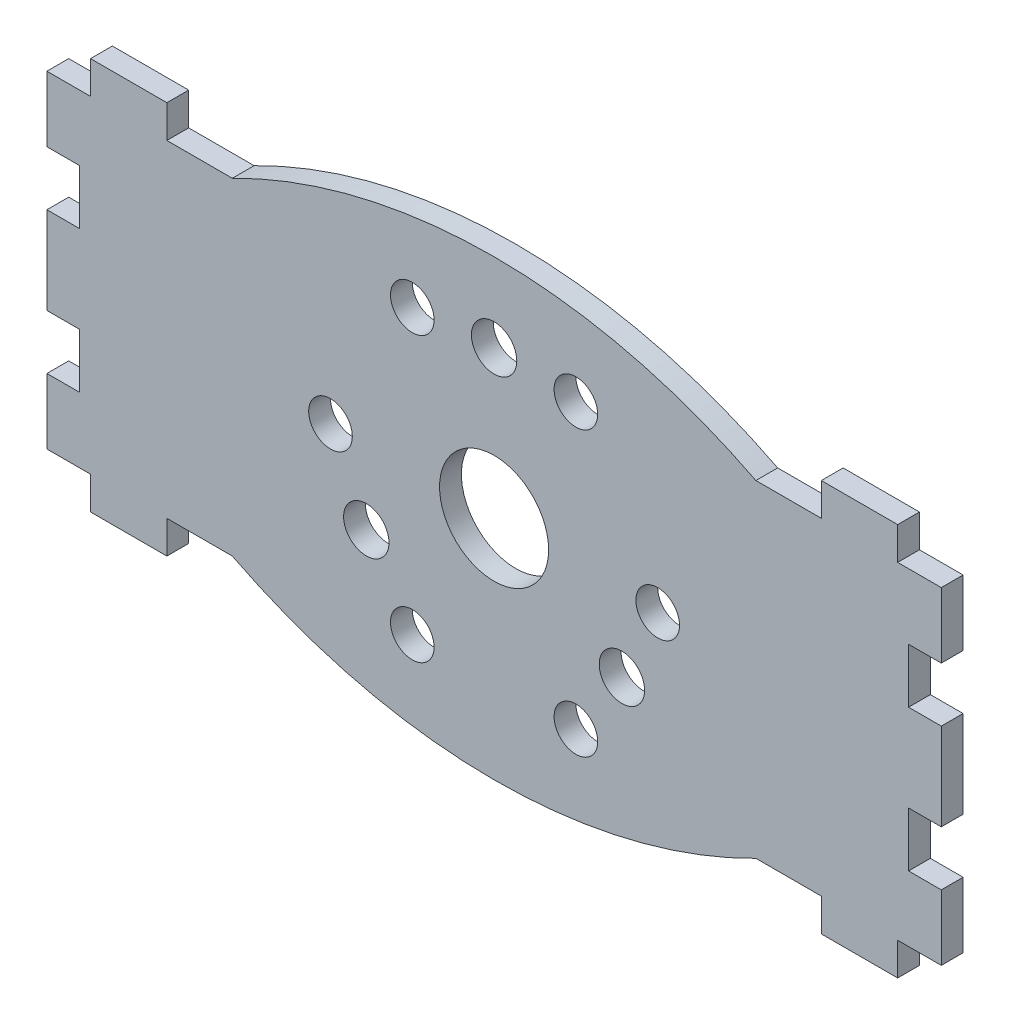
from build123d import *

# Parameters (mm, degrees)
SKETCH_1_R      = 2
SKETCH_1_R_2    = 2.08
SKETCH_1_R_3    = 5
EXTRUDE_2_DEPTH = 2


with BuildPart() as part:
    # 草图1 → 凸台-拉伸2 (new body)
    with BuildSketch(Plane.XY):
        with BuildLine():
            ThreePointArc((-24, -15), (0, -20.769061509), (24, -15))
            Line((24, -15), (30, -15))
            Line((30, -15), (30, -18))
            Line((30, -18), (37, -18))
            Line((37, -18), (37, -15))
            Line((37, -15), (41, -15))
            Line((41, -15), (41, -9))
            Line((41, -9), (38, -9))
            Line((38, -9), (38, -4))
            Line((38, -4), (41, -4))
            Line((41, -4), (41, 4))
            Line((41, 4), (38, 4))
            Line((38, 4), (38, 9))
            Line((38, 9), (41, 9))
            Line((41, 9), (41, 15))
            Line((41, 15), (37, 15))
            Line((37, 15), (37, 18))
            Line((37, 18), (30, 18))
            Line((30, 18), (30, 15))
            Line((30, 15), (24, 15))
            ThreePointArc((24, 15), (0, 20.769061509), (-24, 15))
            Line((-24, 15), (-30, 15))
            Line((-30, 15), (-30, 18))
            Line((-30, 18), (-37, 18))
            Line((-37, 18), (-37, 15))
            Line((-37, 15), (-41, 15))
            Line((-41, 15), (-41, 9))
            Line((-41, 9), (-38, 9))
            Line((-38, 9), (-38, 4))
            Line((-38, 4), (-41, 4))
            Line((-41, 4), (-41, -4))
            Line((-41, -4), (-38, -4))
            Line((-38, -4), (-38, -9))
            Line((-38, -9), (-41, -9))
            Line((-41, -9), (-41, -15))
            Line((-41, -15), (-37, -15))
            Line((-37, -15), (-37, -18))
            Line((-37, -18), (-30, -18))
            Line((-30, -18), (-30, -15))
            Line((-30, -15), (-24, -15))
        make_face()
        with Locations((7.5, 12.990381057)):
            Circle(SKETCH_1_R, mode=Mode.SUBTRACT)
        with Locations((0, 13.53)):
            Circle(SKETCH_1_R_2, mode=Mode.SUBTRACT)
        with Locations((-7.5, 12.990381057)):
            Circle(SKETCH_1_R, mode=Mode.SUBTRACT)
        with Locations((-15, 0)):
            Circle(SKETCH_1_R, mode=Mode.SUBTRACT)
        with Locations((-11.717323713, -6.765)):
            Circle(SKETCH_1_R_2, mode=Mode.SUBTRACT)
        with Locations((-7.5, -12.990381057)):
            Circle(SKETCH_1_R, mode=Mode.SUBTRACT)
        with Locations((7.5, -12.990381057)):
            Circle(SKETCH_1_R, mode=Mode.SUBTRACT)
        with Locations((11.717323713, -6.765)):
            Circle(SKETCH_1_R_2, mode=Mode.SUBTRACT)
        with Locations((15, 0)):
            Circle(SKETCH_1_R, mode=Mode.SUBTRACT)
        Circle(SKETCH_1_R_3, mode=Mode.SUBTRACT)
    extrude(amount=EXTRUDE_2_DEPTH)


solid = part.part
